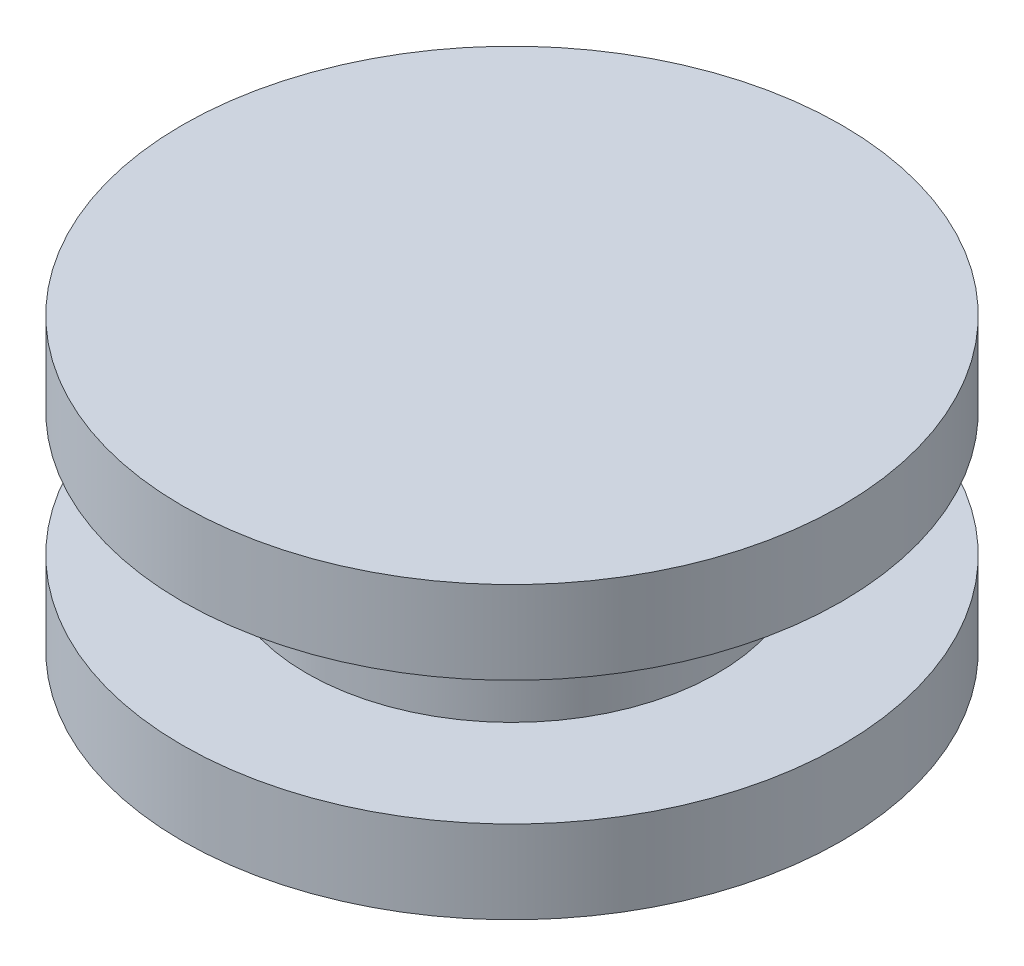
from build123d import *

# Parameters (mm, degrees)
SKETCH1_R           = 2.475
BOSS_EXTRUDE1_DEPTH = 0.75
SKETCH3_R           = 3.975
BOSS_EXTRUDE2_DEPTH = 1


with BuildPart() as part:
    # Sketch1 → Boss-Extrude1 (new, symmetric)
    with BuildSketch(Plane(origin=(0, 0, 0), x_dir=(1, 0, 0), z_dir=(0, 1, 0))):
        with Locations(Location((0, 0, 0), (0, 0, 270))):
            Circle(SKETCH1_R)
    extrude(amount=BOSS_EXTRUDE1_DEPTH, both=True)

    # Sketch3 → Boss-Extrude2 (add)
    with BuildSketch(Plane(origin=(0, 0.75, 0), x_dir=(1, 0, 0), z_dir=(0, 1, 0))):
        with Locations(Location((0, 0, 0), (0, 0, 270))):
            Circle(SKETCH3_R)
    boss_extrude2 = extrude(amount=BOSS_EXTRUDE2_DEPTH)

    # Mirror1: Boss-Extrude2 across plane
    add(boss_extrude2.mirror(Plane.ZX))


solid = part.part
